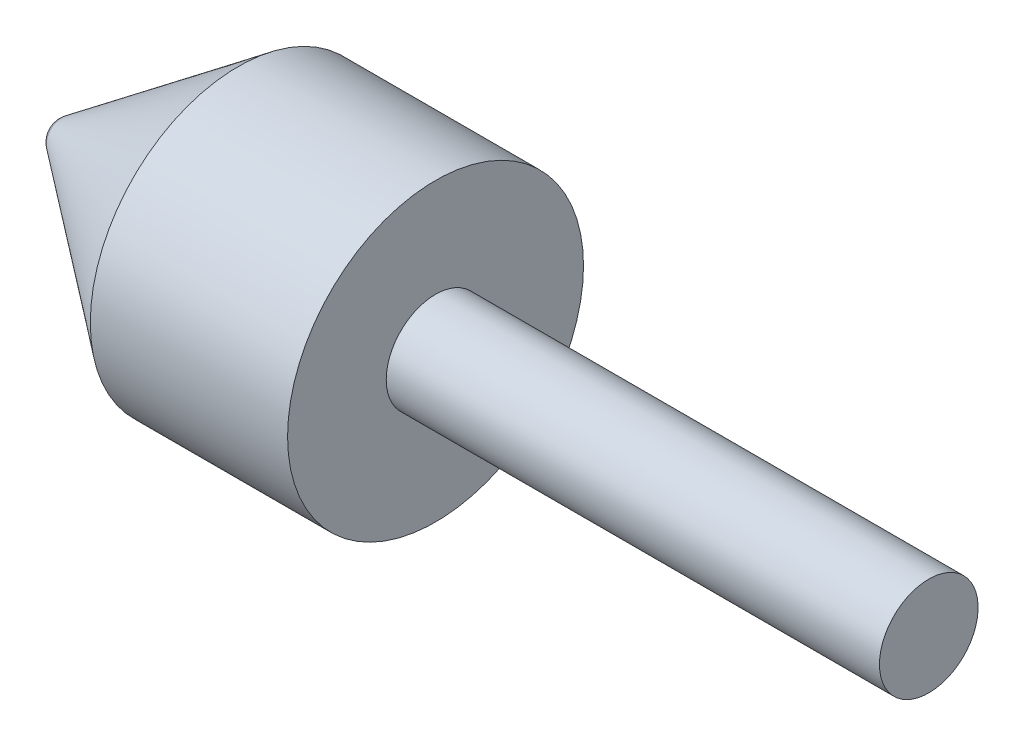
from build123d import *


with BuildPart() as part:
    # Sketch1 → Revolve1 (revolve)
    with BuildSketch(Plane.XY):
        with BuildLine():
            Line((0, 0), (0, 0.5))
            Line((0, 0.5), (-5, 0.5))
            Line((-5, 0.5), (-5, 1.5))
            Line((-5, 1.5), (-7, 1.5))
            Line((-7, 1.5), (-8.786666667, 0.16))
            ThreePointArc((-8.786666667, 0.16), (-8.845552105, 0.089442719), (-8.866666667, 0))
            Line((-8.866666667, 0), (0, 0))
        make_face()
    revolve(axis=Axis((-8.866666667, 0, 0), (1, 0, 0)))


solid = part.part
